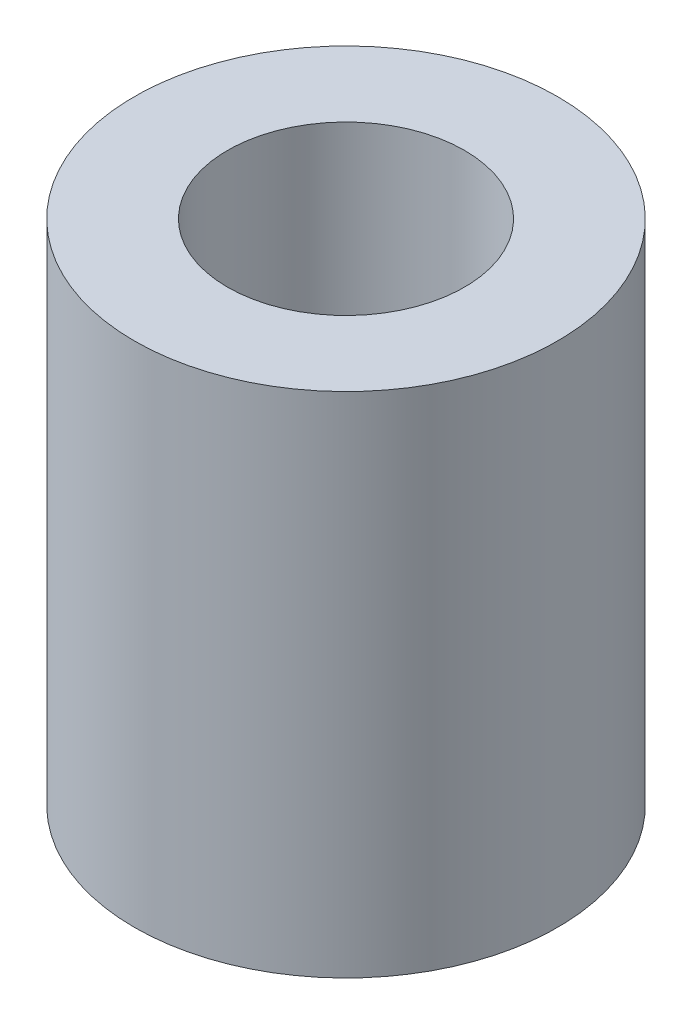
from build123d import *

# Parameters (mm, degrees)
SKETCH_1_R          = 12.5
EXTRUDE_1_DEPTH     = 30
SKETCH_2_R          = 7
CUT_EXTRUDE_1_DEPTH = 10
SKETCH_3_R          = 4
CUT_EXTRUDE_2_DEPTH = 10


with BuildPart() as part:
    # 草图1 → 凸台-拉伸1 (new body)
    with BuildSketch(Plane(origin=(0, 0, 0), x_dir=(1, 0, 0), z_dir=(0, 1, 0))):
        with Locations(Location((0, 0, 0), (0, 0, 270))):
            Circle(SKETCH_1_R)
    extrude(amount=EXTRUDE_1_DEPTH)

    # 草图2 → 切除-拉伸1 (cut)
    with BuildSketch(Plane(origin=(0, 30, 0), x_dir=(1, 0, 0), z_dir=(0, 1, 0))):
        with Locations(Location((0, 0, 0), (0, 0, 270))):
            Circle(SKETCH_2_R)
    extrude(amount=-CUT_EXTRUDE_1_DEPTH, mode=Mode.SUBTRACT)

    # 草图3 → 切除-拉伸2 (cut)
    with BuildSketch(Plane.XZ):
        with Locations(Location((0, 0, 0), (0, 0, 270))):
            Circle(SKETCH_3_R)
    extrude(amount=-CUT_EXTRUDE_2_DEPTH, mode=Mode.SUBTRACT)


solid = part.part
